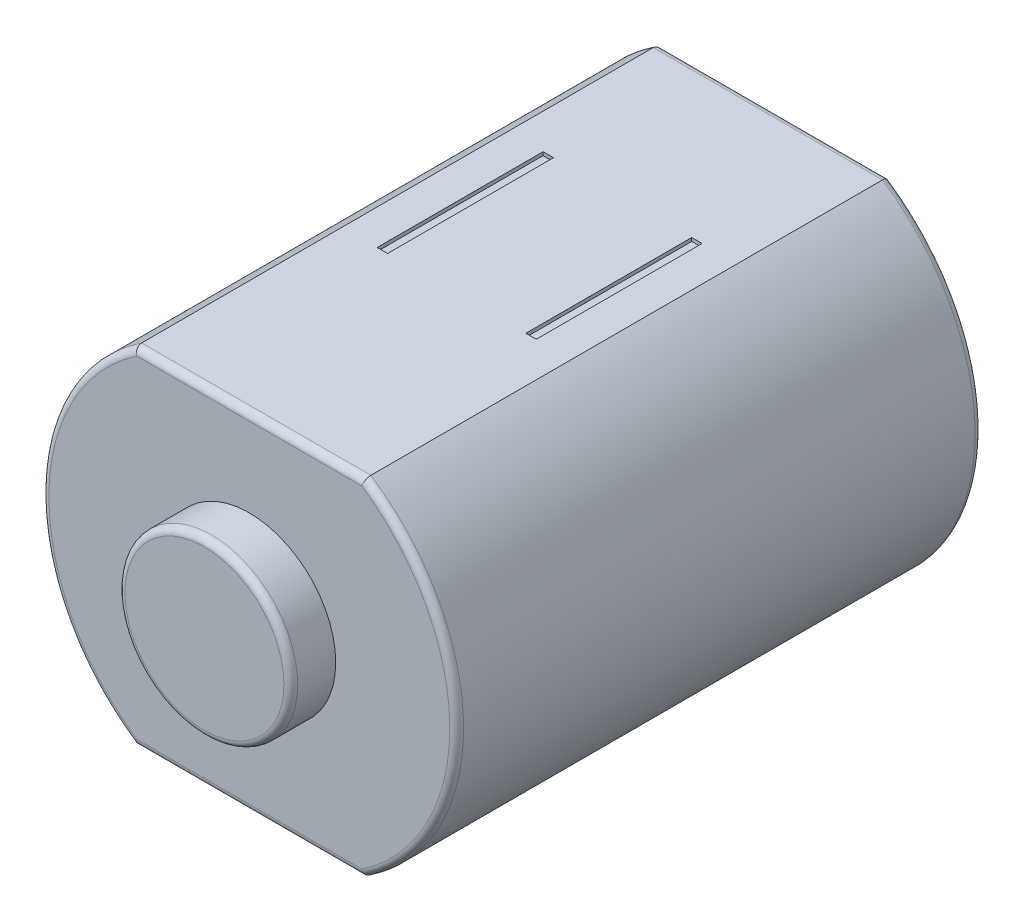
from build123d import *

# Parameters (mm, degrees)
AUFSATZ_LINEAR_AUSTRAGEN1_DEPTH = 15.2
SKIZZE2_R                       = 2.5
AUFSATZ_LINEAR_AUSTRAGEN2_DEPTH = 1.3
SKIZZE3_R                       = 0.5
AUFSATZ_LINEAR_AUSTRAGEN3_DEPTH = 2
VERRUNDUNG1_R                   = 0.2
SKIZZE4_W                       = 0.3
SKIZZE4_H                       = 4.8
SCHNITT_LINEAR_AUSTRAGEN1_DEPTH = 0.1


with BuildPart() as part:
    # Skizze1 → Aufsatz-Linear austragen1 (new body)
    with BuildSketch(Plane.XY):
        with BuildLine():
            Line((-3.31662479, 5), (3.31662479, 5))
            ThreePointArc((3.31662479, 5), (6, 0), (3.31662479, -5))
            Line((3.31662479, -5), (-3.31662479, -5))
            ThreePointArc((-3.31662479, -5), (-6, 0), (-3.31662479, 5))
        make_face()
    extrude(amount=AUFSATZ_LINEAR_AUSTRAGEN1_DEPTH)

    # Skizze2 → Aufsatz-Linear austragen2 (add)
    with BuildSketch(Plane.XY.offset(15.2)):
        Circle(SKIZZE2_R)
    extrude(amount=AUFSATZ_LINEAR_AUSTRAGEN2_DEPTH)

    # Skizze3 → Aufsatz-Linear austragen3 (add)
    with BuildSketch(Plane(origin=(0, 0, 0), x_dir=(-1, 0, 0), z_dir=(0, 0, -1))):
        with Locations(Location((0, 0, 0), (0, 0, 180))):
            Circle(SKIZZE3_R)
    extrude(amount=AUFSATZ_LINEAR_AUSTRAGEN3_DEPTH)

    # Verrundung1
    verrundung1_edges = [part.edges().sort_by_distance(p)[0] for p in [
        (6, 0, 15.2),
        (0, 5, 15.2),
        (-2.5, 0, 16.5),
        (-6, 0, 15.2),
        (0, 5, 0),
        (6, 0, 0),
        (0, -5, 0),
        (-6, 0, 0),
        (0, -5, 15.2),
    ]]
    fillet(verrundung1_edges, radius=VERRUNDUNG1_R)

    # Skizze4 → Schnitt-Linear austragen1 (cut)
    with BuildSketch(Plane(origin=(0, 5, 0), x_dir=(1, 0, 0), z_dir=(0, 1, 0))):
        with Locations((-2.15, -6.8)):
            Rectangle(SKIZZE4_W, SKIZZE4_H)
        with Locations((2.15, -6.8)):
            Rectangle(SKIZZE4_W, SKIZZE4_H)
    schnitt_linear_austragen1 = extrude(amount=-SCHNITT_LINEAR_AUSTRAGEN1_DEPTH, mode=Mode.SUBTRACT)

    # Spiegeln1: Schnitt-Linear austragen1 across plane
    add(schnitt_linear_austragen1.mirror(Plane.ZX), mode=Mode.SUBTRACT)


solid = part.part
